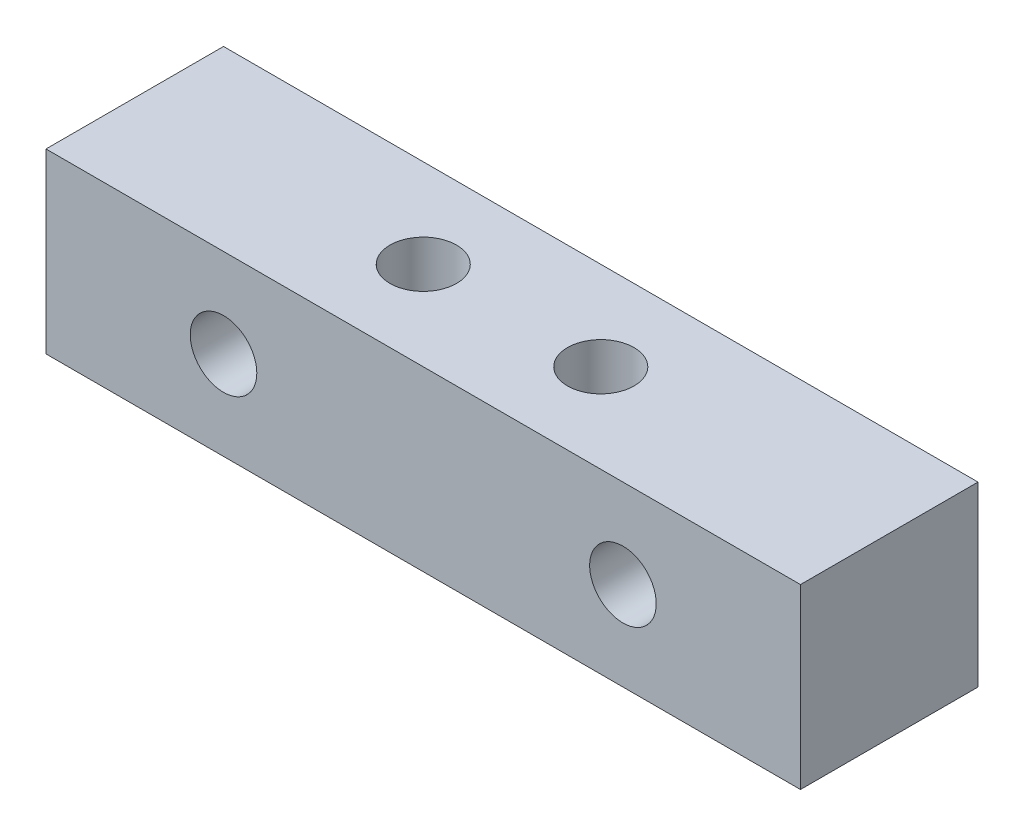
from build123d import *

# Parameters (mm, degrees)
SKETCH_1_W          = 34
SKETCH_1_H          = 8
EXTRUDE_1_DEPTH     = 8
SKETCH_2_R          = 1.5
CUT_EXTRUDE_1_DEPTH = 36.832945734
SKETCH_3_R          = 1.5
CUT_EXTRUDE_2_DEPTH = 36.832945734


with BuildPart() as part:
    # 草图1 → 凸台-拉伸1 (new body)
    with BuildSketch(Plane.XY):
        with Locations((17, 4)):
            Rectangle(SKETCH_1_W, SKETCH_1_H)
    extrude(amount=EXTRUDE_1_DEPTH)

    # 草图2 → 切除-拉伸1 (cut, through all)
    with BuildSketch(Plane.XY.offset(8)):
        with Locations((8, 4)):
            Circle(SKETCH_2_R)
        with Locations((26, 4)):
            Circle(SKETCH_2_R)
    extrude(amount=-CUT_EXTRUDE_1_DEPTH, mode=Mode.SUBTRACT)

    # 草图3 → 切除-拉伸2 (cut, through all)
    with BuildSketch(Plane(origin=(0, 8, 0), x_dir=(1, 0, 0), z_dir=(0, 1, 0))):
        with Locations(Location((13, -4, 0), (0, 0, 270))):
            Circle(SKETCH_3_R)
        with Locations(Location((21, -4, 0), (0, 0, 270))):
            Circle(SKETCH_3_R)
    extrude(amount=-CUT_EXTRUDE_2_DEPTH, mode=Mode.SUBTRACT)


solid = part.part
